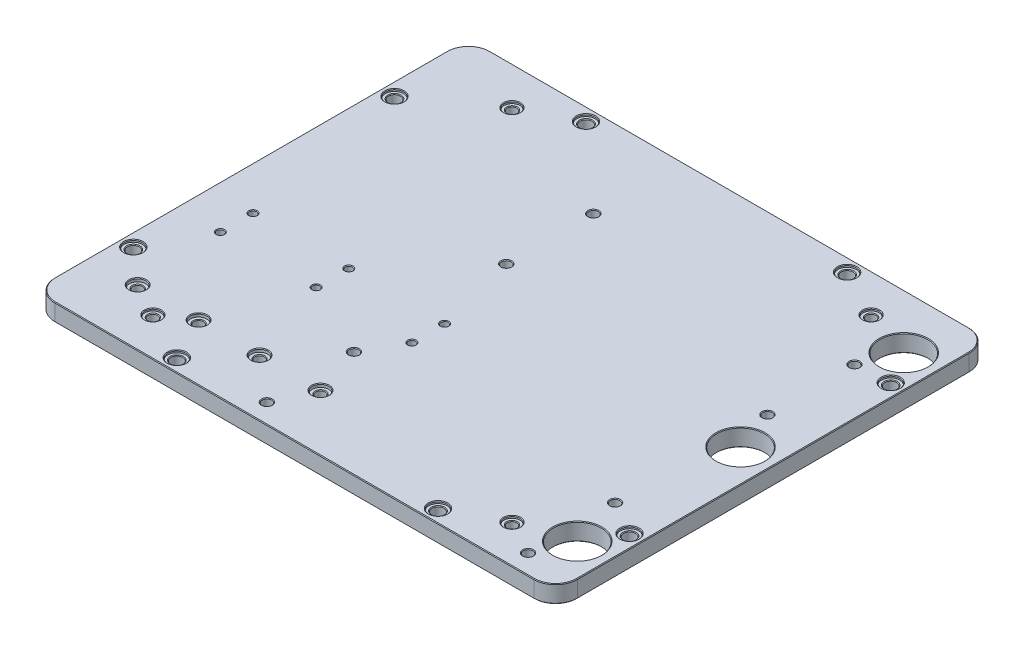
from build123d import *

# Parameters (mm, degrees)
SKETCH_1_W           = 240
SKETCH_1_H           = 200
EXTRUDE_1_DEPTH      = 8
SKETCH_2_W           = 98
SKETCH_2_H           = 6
CUT_EXTRUDE_1_DEPTH  = 2
SKETCH_3_R           = 2.2
CUT_EXTRUDE_2_DEPTH  = 10
SKETCH_4_W           = 8
SKETCH_4_H           = 60
CUT_EXTRUDE_3_DEPTH  = 1
SKETCH_5_R           = 1.65
CUT_EXTRUDE_4_DEPTH  = 10
SKETCH_6_R           = 1
CUT_EXTRUDE_5_DEPTH  = 1
SKETCH_7_R           = 1
CUT_EXTRUDE_6_DEPTH  = 2
SKETCH_8_R           = 3.75
CUT_EXTRUDE_7_DEPTH  = 1.5
SKETCH_9_R           = 2.2
CUT_EXTRUDE_8_DEPTH  = 10
CUT_EXTRUDE_START    = -5.5
SKETCH_9_3_R         = 4
SKETCH_9_3_R_2       = 2.2
CUT_EXTRUDE_9_DEPTH  = 10
SKETCH_10_R          = 2.75
CUT_EXTRUDE_10_DEPTH = 10
SKETCH_10_3_R        = 4.5
SKETCH_10_3_R_2      = 2.75
CUT_EXTRUDE_11_DEPTH = 10
FILLET_1_R           = 10
SKETCH_11_R          = 2.2
CUT_EXTRUDE_12_DEPTH = 10
CUT_EXTRUDE_START_2  = 7.5
SKETCH_11_3_R        = 4
SKETCH_11_3_R_2      = 2.2
CUT_EXTRUDE_13_DEPTH = 10
SKETCH_12_R          = 4.15
CUT_EXTRUDE_14_DEPTH = 1
SKETCH_13_R          = 3.65
CUT_EXTRUDE_15_DEPTH = 1
SKETCH_14_R          = 11
CUT_EXTRUDE_16_DEPTH = 10
CHAMFER_1_SIZE       = 0.3


with BuildPart() as part:
    # 스케치1 → 보스-돌출1 (new body)
    with BuildSketch(Plane(origin=(0, 0, 0), x_dir=(1, 0, 0), z_dir=(0, 1, 0))):
        Rectangle(SKETCH_1_W, SKETCH_1_H)
    extrude(amount=EXTRUDE_1_DEPTH)

    # 스케치2 → 컷-돌출1 (cut)
    with BuildSketch(Plane.XZ):
        with Locations((-56, 74)):
            Rectangle(SKETCH_2_W, SKETCH_2_H)
    extrude(amount=-CUT_EXTRUDE_1_DEPTH, mode=Mode.SUBTRACT)

    # 스케치3 → 컷-돌출2 (cut)
    with BuildSketch(Plane.XZ.offset(-2)):
        with Locations((-98, 74)):
            Circle(SKETCH_3_R)
        with Locations((-70, 74)):
            Circle(SKETCH_3_R)
        with Locations((-42, 74)):
            Circle(SKETCH_3_R)
        with Locations((-14, 74)):
            Circle(SKETCH_3_R)
    extrude(amount=-CUT_EXTRUDE_2_DEPTH, mode=Mode.SUBTRACT)

    # 스케치4 → 컷-돌출3 (cut)
    with BuildSketch(Plane.XZ):
        with Locations((-12, 41)):
            Rectangle(SKETCH_4_W, SKETCH_4_H)
        with Locations((-100, 41)):
            Rectangle(SKETCH_4_W, SKETCH_4_H)
        with Locations((-56, 41)):
            Rectangle(SKETCH_4_W, SKETCH_4_H)
    extrude(amount=-CUT_EXTRUDE_3_DEPTH, mode=Mode.SUBTRACT)

    # 스케치5 → 컷-돌출4 (cut)
    with BuildSketch(Plane.XZ.offset(-1)):
        with Locations((-12, 19)):
            Circle(SKETCH_5_R)
        with Locations((-12, 34)):
            Circle(SKETCH_5_R)
        with Locations((-100, 34)):
            Circle(SKETCH_5_R)
        with Locations((-100, 19)):
            Circle(SKETCH_5_R)
        with Locations((-56, 34)):
            Circle(SKETCH_5_R)
        with Locations((-56, 19)):
            Circle(SKETCH_5_R)
    extrude(amount=-CUT_EXTRUDE_4_DEPTH, mode=Mode.SUBTRACT)

    # 스케치6 → 컷-돌출5 (cut)
    with BuildSketch(Plane.XZ):
        with Locations((-104, 11)):
            Circle(SKETCH_6_R)
        with Locations((-96, 11)):
            Circle(SKETCH_6_R)
        with Locations((-60, 11)):
            Circle(SKETCH_6_R)
        with Locations((-52, 11)):
            Circle(SKETCH_6_R)
        with Locations((-16, 11)):
            Circle(SKETCH_6_R)
        with Locations((-8, 11)):
            Circle(SKETCH_6_R)
    extrude(amount=-CUT_EXTRUDE_5_DEPTH, mode=Mode.SUBTRACT)

    # 스케치7 → 컷-돌출6 (cut)
    with BuildSketch(Plane.XZ):
        with Locations((-105, 76)):
            Circle(SKETCH_7_R)
        with Locations((-105, 72)):
            Circle(SKETCH_7_R)
        with Locations((-7, 76)):
            Circle(SKETCH_7_R)
        with Locations((-7, 72)):
            Circle(SKETCH_7_R)
    extrude(amount=-CUT_EXTRUDE_6_DEPTH, mode=Mode.SUBTRACT)

    # 스케치8 → 컷-돌출7 (cut)
    with BuildSketch(Plane(origin=(0, 8, 0), x_dir=(1, 0, 0), z_dir=(0, 1, 0))):
        with Locations((-98, -74)):
            Circle(SKETCH_8_R)
        with Locations((-70, -74)):
            Circle(SKETCH_8_R)
        with Locations((-42, -74)):
            Circle(SKETCH_8_R)
        with Locations((-14, -74)):
            Circle(SKETCH_8_R)
    extrude(amount=-CUT_EXTRUDE_7_DEPTH, mode=Mode.SUBTRACT)

    # 스케치9 → 컷-돌출8 (cut)
    with BuildSketch(Plane(origin=(0, 8, 0), x_dir=(1, 0, 0), z_dir=(0, 1, 0))):
        with Locations((98.37, 19)):
            Circle(SKETCH_9_R)
        with Locations((98.37, -51)):
            Circle(SKETCH_9_R)
        with Locations((98.37, -91)):
            Circle(SKETCH_9_R)
        with Locations((98.37, 59)):
            Circle(SKETCH_9_R)
        with Locations((-21.63, -91)):
            Circle(SKETCH_9_R)
        with Locations((-21.63, -51)):
            Circle(SKETCH_9_R)
        with Locations((-21.63, 19)):
            Circle(SKETCH_9_R)
        with Locations((-21.63, 59)):
            Circle(SKETCH_9_R)
    extrude(amount=-CUT_EXTRUDE_8_DEPTH, mode=Mode.SUBTRACT)

    # 스케치9<3> → 컷-돌출9 (cut)
    # profile 1 of 8: a face of its own
    with BuildSketch(Plane(origin=(0, 8, 0), x_dir=(1, 0, 0), z_dir=(0, 1, 0)).offset(CUT_EXTRUDE_START)):
        with Locations((98.37, 59)):
            Circle(SKETCH_9_3_R)
        with Locations((98.37, 59)):
            Circle(SKETCH_9_3_R_2, mode=Mode.SUBTRACT)
    # profile 2 of 8: a face of its own
    with BuildSketch(Plane(origin=(0, 8, 0), x_dir=(1, 0, 0), z_dir=(0, 1, 0)).offset(CUT_EXTRUDE_START)):
        with Locations((98.37, 19)):
            Circle(SKETCH_9_3_R)
        with Locations((98.37, 19)):
            Circle(SKETCH_9_3_R_2, mode=Mode.SUBTRACT)
    # profile 3 of 8: a face of its own
    with BuildSketch(Plane(origin=(0, 8, 0), x_dir=(1, 0, 0), z_dir=(0, 1, 0)).offset(CUT_EXTRUDE_START)):
        with Locations((98.37, -51)):
            Circle(SKETCH_9_3_R)
        with Locations((98.37, -51)):
            Circle(SKETCH_9_3_R_2, mode=Mode.SUBTRACT)
    # profile 4 of 8: a face of its own
    with BuildSketch(Plane(origin=(0, 8, 0), x_dir=(1, 0, 0), z_dir=(0, 1, 0)).offset(CUT_EXTRUDE_START)):
        with Locations((98.37, -91)):
            Circle(SKETCH_9_3_R)
        with Locations((98.37, -91)):
            Circle(SKETCH_9_3_R_2, mode=Mode.SUBTRACT)
    # profile 5 of 8: a face of its own
    with BuildSketch(Plane(origin=(0, 8, 0), x_dir=(1, 0, 0), z_dir=(0, 1, 0)).offset(CUT_EXTRUDE_START)):
        with Locations((-21.63, -91)):
            Circle(SKETCH_9_3_R)
        with Locations((-21.63, -91)):
            Circle(SKETCH_9_3_R_2, mode=Mode.SUBTRACT)
    # profile 6 of 8: a face of its own
    with BuildSketch(Plane(origin=(0, 8, 0), x_dir=(1, 0, 0), z_dir=(0, 1, 0)).offset(CUT_EXTRUDE_START)):
        with Locations((-21.63, -51)):
            Circle(SKETCH_9_3_R)
        with Locations((-21.63, -51)):
            Circle(SKETCH_9_3_R_2, mode=Mode.SUBTRACT)
    # profile 7 of 8: a face of its own
    with BuildSketch(Plane(origin=(0, 8, 0), x_dir=(1, 0, 0), z_dir=(0, 1, 0)).offset(CUT_EXTRUDE_START)):
        with Locations((-21.63, 19)):
            Circle(SKETCH_9_3_R)
        with Locations((-21.63, 19)):
            Circle(SKETCH_9_3_R_2, mode=Mode.SUBTRACT)
    # profile 8 of 8: a face of its own
    with BuildSketch(Plane(origin=(0, 8, 0), x_dir=(1, 0, 0), z_dir=(0, 1, 0)).offset(CUT_EXTRUDE_START)):
        with Locations((-21.63, 59)):
            Circle(SKETCH_9_3_R)
        with Locations((-21.63, 59)):
            Circle(SKETCH_9_3_R_2, mode=Mode.SUBTRACT)
    extrude(amount=-CUT_EXTRUDE_9_DEPTH, mode=Mode.SUBTRACT)

    # 스케치10 → 컷-돌출10 (cut)
    with BuildSketch(Plane(origin=(0, 8, 0), x_dir=(1, 0, 0), z_dir=(0, 1, 0))):
        with Locations((-114, 60)):
            Circle(SKETCH_10_R)
        with Locations((-114, -60)):
            Circle(SKETCH_10_R)
        with Locations((-60, 94)):
            Circle(SKETCH_10_R)
        with Locations((60, 94)):
            Circle(SKETCH_10_R)
        with Locations((60, -94)):
            Circle(SKETCH_10_R)
        with Locations((-60, -94)):
            Circle(SKETCH_10_R)
        with Locations((114, -60)):
            Circle(SKETCH_10_R)
        with Locations((114, 60)):
            Circle(SKETCH_10_R)
    extrude(amount=-CUT_EXTRUDE_10_DEPTH, mode=Mode.SUBTRACT)

    # 스케치10<3> → 컷-돌출11 (cut)
    # profile 1 of 8: a face of its own
    with BuildSketch(Plane(origin=(0, 8, 0), x_dir=(1, 0, 0), z_dir=(0, 1, 0)).offset(CUT_EXTRUDE_START)):
        with Locations((-114, 60)):
            Circle(SKETCH_10_3_R)
        with Locations((-114, 60)):
            Circle(SKETCH_10_3_R_2, mode=Mode.SUBTRACT)
    # profile 2 of 8: a face of its own
    with BuildSketch(Plane(origin=(0, 8, 0), x_dir=(1, 0, 0), z_dir=(0, 1, 0)).offset(CUT_EXTRUDE_START)):
        with Locations((-114, -60)):
            Circle(SKETCH_10_3_R)
        with Locations((-114, -60)):
            Circle(SKETCH_10_3_R_2, mode=Mode.SUBTRACT)
    # profile 3 of 8: a face of its own
    with BuildSketch(Plane(origin=(0, 8, 0), x_dir=(1, 0, 0), z_dir=(0, 1, 0)).offset(CUT_EXTRUDE_START)):
        with Locations((-60, 94)):
            Circle(SKETCH_10_3_R)
        with Locations((-60, 94)):
            Circle(SKETCH_10_3_R_2, mode=Mode.SUBTRACT)
    # profile 4 of 8: a face of its own
    with BuildSketch(Plane(origin=(0, 8, 0), x_dir=(1, 0, 0), z_dir=(0, 1, 0)).offset(CUT_EXTRUDE_START)):
        with Locations((60, 94)):
            Circle(SKETCH_10_3_R)
        with Locations((60, 94)):
            Circle(SKETCH_10_3_R_2, mode=Mode.SUBTRACT)
    # profile 5 of 8: a face of its own
    with BuildSketch(Plane(origin=(0, 8, 0), x_dir=(1, 0, 0), z_dir=(0, 1, 0)).offset(CUT_EXTRUDE_START)):
        with Locations((60, -94)):
            Circle(SKETCH_10_3_R)
        with Locations((60, -94)):
            Circle(SKETCH_10_3_R_2, mode=Mode.SUBTRACT)
    # profile 6 of 8: a face of its own
    with BuildSketch(Plane(origin=(0, 8, 0), x_dir=(1, 0, 0), z_dir=(0, 1, 0)).offset(CUT_EXTRUDE_START)):
        with Locations((-60, -94)):
            Circle(SKETCH_10_3_R)
        with Locations((-60, -94)):
            Circle(SKETCH_10_3_R_2, mode=Mode.SUBTRACT)
    # profile 7 of 8: a face of its own
    with BuildSketch(Plane(origin=(0, 8, 0), x_dir=(1, 0, 0), z_dir=(0, 1, 0)).offset(CUT_EXTRUDE_START)):
        with Locations((114, -60)):
            Circle(SKETCH_10_3_R)
        with Locations((114, -60)):
            Circle(SKETCH_10_3_R_2, mode=Mode.SUBTRACT)
    # profile 8 of 8: a face of its own
    with BuildSketch(Plane(origin=(0, 8, 0), x_dir=(1, 0, 0), z_dir=(0, 1, 0)).offset(CUT_EXTRUDE_START)):
        with Locations((114, 60)):
            Circle(SKETCH_10_3_R)
        with Locations((114, 60)):
            Circle(SKETCH_10_3_R_2, mode=Mode.SUBTRACT)
    extrude(amount=-CUT_EXTRUDE_11_DEPTH, mode=Mode.SUBTRACT)

    # 필렛1
    fillet_1_edges = [part.edges().sort_by_distance(p)[0] for p in [
        (120, 4, 100),
        (120, 4, -100),
        (-120, 4, -100),
        (-120, 4, 100),
    ]]
    fillet(fillet_1_edges, radius=FILLET_1_R)

    # 스케치11 → 컷-돌출12 (cut)
    with BuildSketch(Plane.XZ):
        with Locations((-82.5, -82.5)):
            Circle(SKETCH_11_R)
        with Locations((82.5, -82.5)):
            Circle(SKETCH_11_R)
        with Locations((-82.5, 82.5)):
            Circle(SKETCH_11_R)
        with Locations((82.5, 82.5)):
            Circle(SKETCH_11_R)
    extrude(amount=-CUT_EXTRUDE_12_DEPTH, mode=Mode.SUBTRACT)

    # 스케치11<3> → 컷-돌출13 (cut)
    # profile 1 of 4: a face of its own
    with BuildSketch(Plane.XZ.offset(CUT_EXTRUDE_START_2)):
        with Locations((-82.5, -82.5)):
            Circle(SKETCH_11_3_R)
        with Locations((-82.5, -82.5)):
            Circle(SKETCH_11_3_R_2, mode=Mode.SUBTRACT)
    # profile 2 of 4: a face of its own
    with BuildSketch(Plane.XZ.offset(CUT_EXTRUDE_START_2)):
        with Locations((82.5, -82.5)):
            Circle(SKETCH_11_3_R)
        with Locations((82.5, -82.5)):
            Circle(SKETCH_11_3_R_2, mode=Mode.SUBTRACT)
    # profile 3 of 4: a face of its own
    with BuildSketch(Plane.XZ.offset(CUT_EXTRUDE_START_2)):
        with Locations((-82.5, 82.5)):
            Circle(SKETCH_11_3_R)
        with Locations((-82.5, 82.5)):
            Circle(SKETCH_11_3_R_2, mode=Mode.SUBTRACT)
    # profile 4 of 4: a face of its own
    with BuildSketch(Plane.XZ.offset(CUT_EXTRUDE_START_2)):
        with Locations((82.5, 82.5)):
            Circle(SKETCH_11_3_R)
        with Locations((82.5, 82.5)):
            Circle(SKETCH_11_3_R_2, mode=Mode.SUBTRACT)
    extrude(amount=-CUT_EXTRUDE_13_DEPTH, mode=Mode.SUBTRACT)

    # 스케치12 → 컷-돌출14 (cut)
    with BuildSketch(Plane(origin=(0, 8, 0), x_dir=(1, 0, 0), z_dir=(0, 1, 0))):
        with Locations((-60, 94)):
            Circle(SKETCH_12_R)
        with Locations((-114, 60)):
            Circle(SKETCH_12_R)
        with Locations((-114, -60)):
            Circle(SKETCH_12_R)
        with Locations((-60, -94)):
            Circle(SKETCH_12_R)
        with Locations((60, -94)):
            Circle(SKETCH_12_R)
        with Locations((114, -60)):
            Circle(SKETCH_12_R)
        with Locations((114, 60)):
            Circle(SKETCH_12_R)
        with Locations((60, 94)):
            Circle(SKETCH_12_R)
    extrude(amount=-CUT_EXTRUDE_14_DEPTH, mode=Mode.SUBTRACT)

    # 스케치13 → 컷-돌출15 (cut)
    with BuildSketch(Plane(origin=(0, 8, 0), x_dir=(1, 0, 0), z_dir=(0, 1, 0))):
        with Locations((-82.5, 82.5)):
            Circle(SKETCH_13_R)
        with Locations((82.5, 82.5)):
            Circle(SKETCH_13_R)
        with Locations((82.5, -82.5)):
            Circle(SKETCH_13_R)
        with Locations((-82.5, -82.5)):
            Circle(SKETCH_13_R)
    extrude(amount=-CUT_EXTRUDE_15_DEPTH, mode=Mode.SUBTRACT)

    # 스케치14 → 컷-돌출16 (cut)
    with BuildSketch(Plane(origin=(0, 8, 0), x_dir=(1, 0, 0), z_dir=(0, 1, 0))):
        with Locations((105, 75)):
            Circle(SKETCH_14_R)
        with Locations((105, 0)):
            Circle(SKETCH_14_R)
        with Locations((105, -75)):
            Circle(SKETCH_14_R)
    extrude(amount=-CUT_EXTRUDE_16_DEPTH, mode=Mode.SUBTRACT)

    # 모따기1
    chamfer_1_edges = [part.edges().sort_by_distance(p)[0] for p in [
        (96.17, 8, 91),
        (96.17, 8, 51),
        (96.17, 8, -19),
        (96.17, 8, -59),
        (-23.83, 8, 91),
        (-23.83, 8, 51),
        (-13.65, 8, 34),
        (-13.65, 8, 19),
        (-57.65, 8, 34),
        (-57.65, 8, 19),
        (-101.65, 8, 34),
        (-101.65, 8, 19),
        (-23.83, 8, -19),
        (-23.83, 8, -59),
        (94, 8, 75),
        (94, 0, 75),
        (94, 8, 0),
        (94, 0, 0),
        (94, 8, -75),
        (94, 0, -75),
        (-16.2, 2, 74),
        (-44.2, 2, 74),
        (-72.2, 2, 74),
        (-100.2, 2, 74),
        (-101.65, 1, 34),
        (-101.65, 1, 19),
        (-57.65, 1, 34),
        (-57.65, 1, 19),
        (-13.65, 1, 34),
        (-13.65, 1, 19),
        (-100, 1, 71),
        (-56, 1, 71),
        (-12, 1, 71),
        (-7, 0, 74),
        (-105, 0, 74),
        (-6, 0, 76),
        (-106, 0, 76),
        (-56, 0, 77),
        (-104, 0, 41.5),
        (-100, 0, 11),
        (-96, 0, 41.5),
        (-78, 0, 71),
        (-60, 0, 41.5),
        (-56, 0, 11),
        (-52, 0, 41.5),
        (-34, 0, 71),
        (-16, 0, 41.5),
        (-8, 0, 41.5),
        (-12, 0, 11),
        (-25.63, 0, 51),
        (-23.83, 2.5, 51),
        (-25.63, 0, -19),
        (-23.83, 2.5, -19),
        (-25.63, 0, -59),
        (-23.83, 2.5, -59),
        (-118.5, 0, 60),
        (-116.75, 2.5, 60),
        (-86.5, 0, 82.5),
        (-84.7, 2.5, 82.5),
        (-64.5, 0, 94),
        (-62.75, 2.5, 94),
        (-25.63, 0, 91),
        (-23.83, 2.5, 91),
        (55.5, 0, 94),
        (57.25, 2.5, 94),
        (78.5, 0, 82.5),
        (80.3, 2.5, 82.5),
        (94.37, 0, 91),
        (96.17, 2.5, 91),
        (94.37, 0, 51),
        (96.17, 2.5, 51),
        (109.5, 0, 60),
        (111.25, 2.5, 60),
        (94.37, 0, -19),
        (96.17, 2.5, -19),
        (94.37, 0, -59),
        (96.17, 2.5, -59),
        (109.5, 0, -60),
        (111.25, 2.5, -60),
        (55.5, 0, -94),
        (57.25, 2.5, -94),
        (78.5, 0, -82.5),
        (80.3, 2.5, -82.5),
        (-16.2, 6.5, 74),
        (-17.75, 8, 74),
        (-45.75, 8, 74),
        (-44.2, 6.5, 74),
        (-64.15, 8, 94),
        (-62.75, 7, 94),
        (-73.75, 8, 74),
        (-72.2, 6.5, 74),
        (-84.7, 7, 82.5),
        (-86.15, 8, 82.5),
        (-100.2, 6.5, 74),
        (-101.75, 8, 74),
        (-116.75, 7, 60),
        (-118.15, 8, 60),
        (78.85, 8, 82.5),
        (80.3, 7, 82.5),
        (57.25, 7, 94),
        (55.85, 8, 94),
        (111.25, 7, 60),
        (109.85, 8, 60),
        (111.25, 7, -60),
        (109.85, 8, -60),
        (80.3, 7, -82.5),
        (78.85, 8, -82.5),
        (57.25, 7, -94),
        (55.85, 8, -94),
        (-64.15, 8, -94),
        (-62.75, 7, -94),
        (-84.7, 7, -82.5),
        (-86.15, 8, -82.5),
        (-116.75, 7, -60),
        (-118.15, 8, -60),
        (-117.071067812, 0, 97.071067812),
        (0, 0, 100),
        (117.071067812, 0, 97.071067812),
        (120, 0, 0),
        (117.071067812, 0, -97.071067812),
        (0, 0, -100),
        (-117.071067812, 0, -97.071067812),
        (-120, 0, 0),
        (-117.071067812, 8, -97.071067812),
        (-120, 8, 0),
        (-117.071067812, 8, 97.071067812),
        (0, 8, 100),
        (117.071067812, 8, 97.071067812),
        (120, 8, 0),
        (117.071067812, 8, -97.071067812),
        (0, 8, -100),
    ]]
    chamfer(chamfer_1_edges, length=CHAMFER_1_SIZE)


solid = part.part
